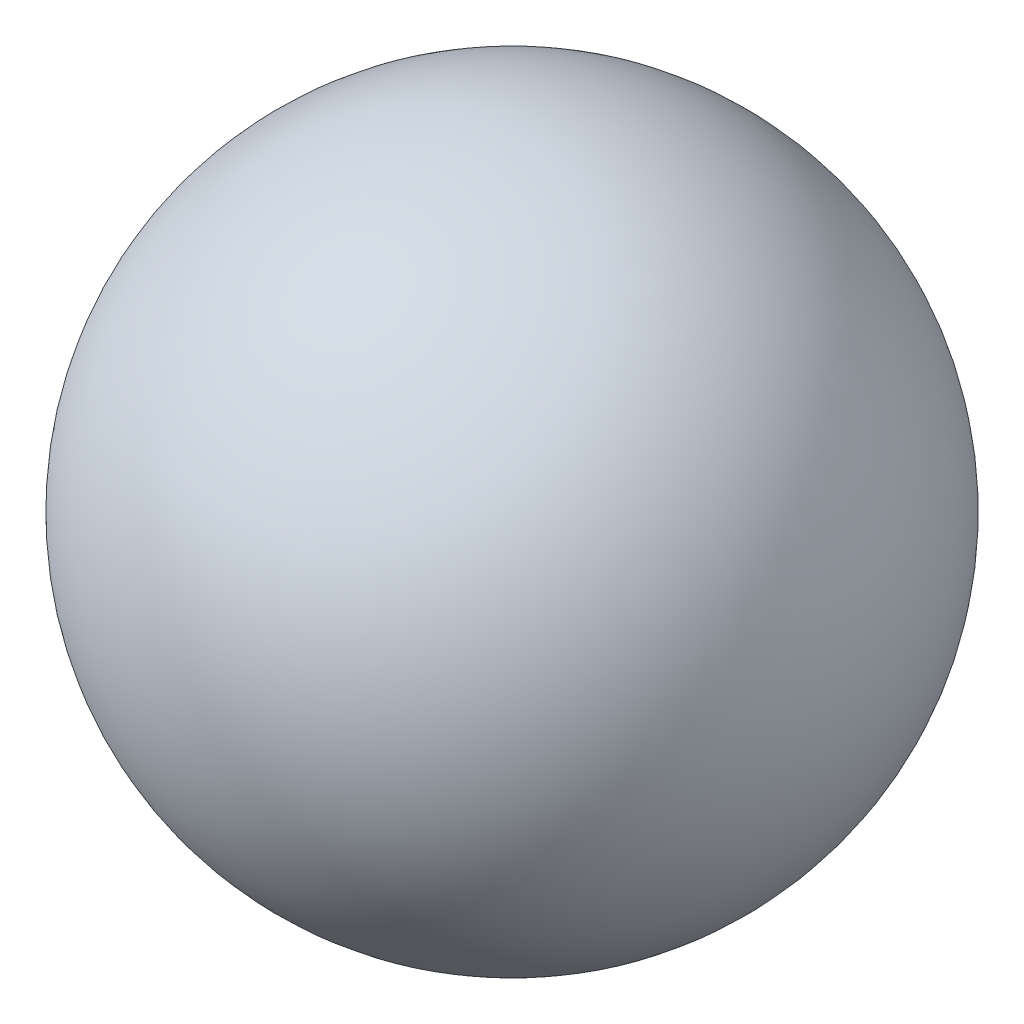
from build123d import *


with BuildPart() as part:
    # Sketch1 → Revolve1 (revolve)
    with BuildSketch(Plane.XY):
        with BuildLine():
            Line((0, 2.25), (0, -2.25))
            ThreePointArc((0, -2.25), (2.25, 0), (0, 2.25))
        make_face()
    revolve(axis=Axis((0, 2.25, 0), (0, -1, 0)))


solid = part.part
